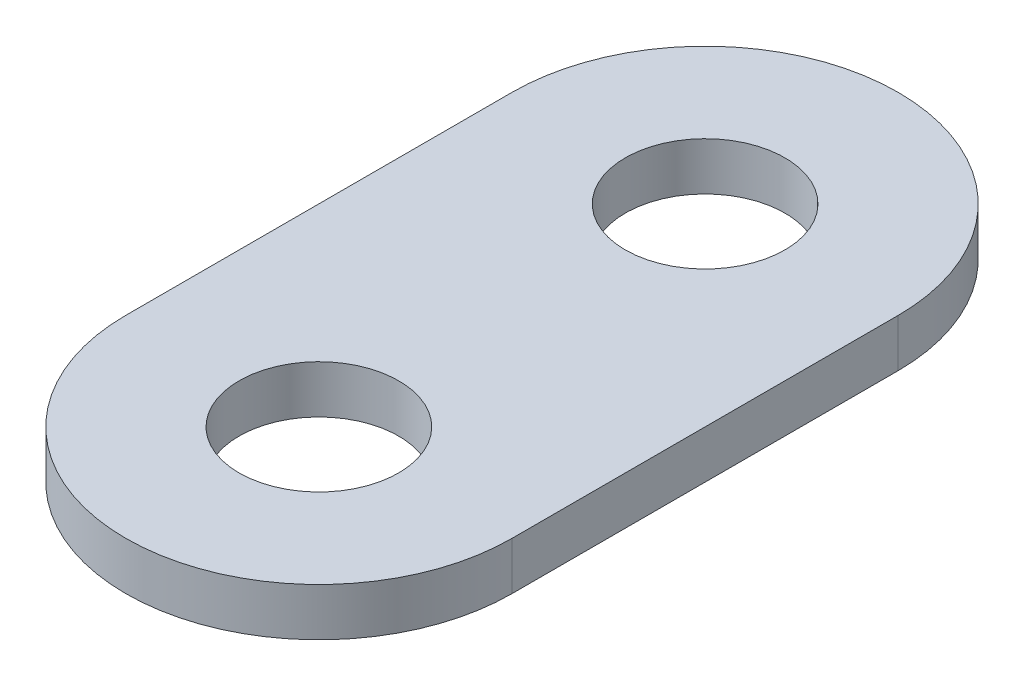
from build123d import *

# Parameters (mm, degrees)
BOSS_EXTRUDE1_DEPTH      = 0.86
BOSS_EXTRUDE1_DEPTH_BACK = 1
SKETCH1_R                = 3.1


with BuildPart() as part:
    # Sketch1 → Boss-Extrude1 (new, two sides: drawn at the far end of the back side and taken through both)
    with BuildSketch(Plane(origin=(0, 0, 0), x_dir=(1, 0, 0), z_dir=(0, 1, 0)).offset(-BOSS_EXTRUDE1_DEPTH_BACK)):
        with BuildLine():
            Line((-7.5, 0), (-7.5, 15))
            ThreePointArc((-7.5, 15), (0, 22.5), (7.5, 15))
            Line((7.5, 15), (7.5, 0))
            ThreePointArc((7.5, 0), (0, -7.5), (-7.5, 0))
        make_face()
        with Locations(Location((0, 0, 0), (0, 0, 270))):
            Circle(SKETCH1_R, mode=Mode.SUBTRACT)
        with Locations(Location((0, 15, 0), (0, 0, 270))):
            Circle(SKETCH1_R, mode=Mode.SUBTRACT)
    extrude(amount=BOSS_EXTRUDE1_DEPTH + BOSS_EXTRUDE1_DEPTH_BACK)


solid = part.part
